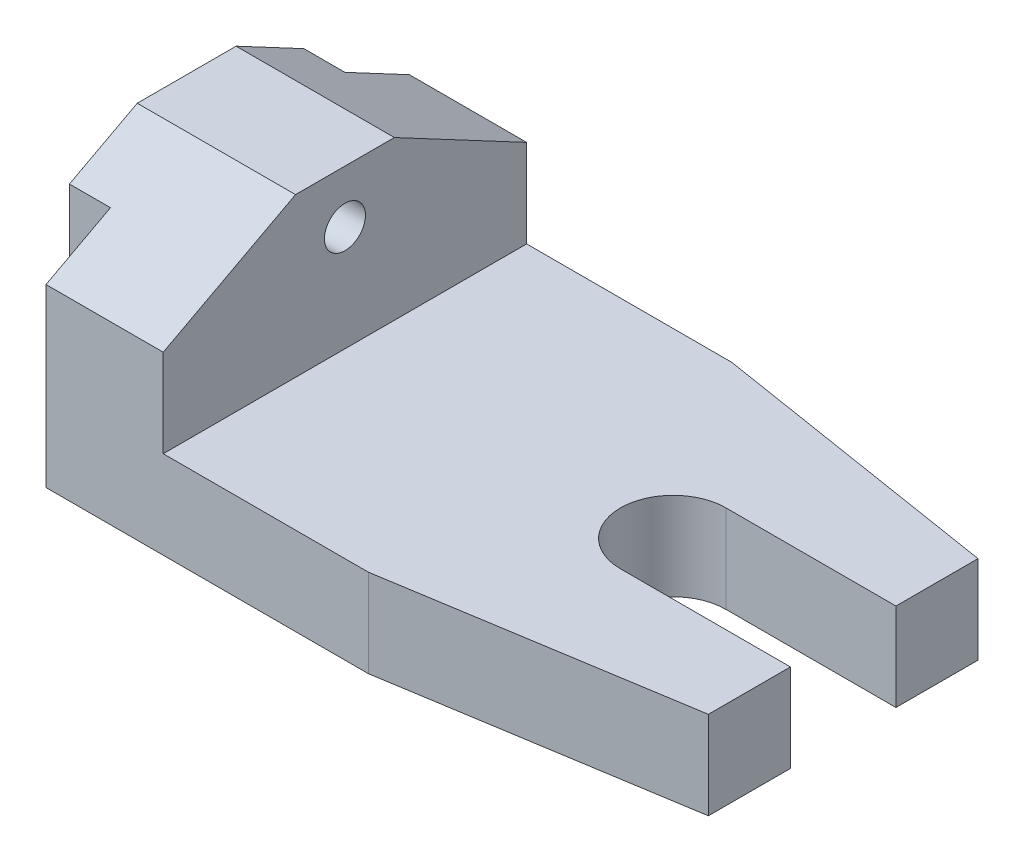
from build123d import *

# Parameters (mm, degrees)
BOSS_EXTRUDE1_DEPTH = 15
BOSS_EXTRUDE2_DEPTH = 42
CUT_EXTRUDE1_REACH  = 101.75
SKETCH2_R           = 3.5


with BuildPart() as part:
    # Sketch1 → Boss-Extrude1 (new body)
    with BuildSketch(Plane(origin=(0, 0, 0), x_dir=(1, 0, 0), z_dir=(0, 1, 0))):
        with BuildLine():
            ThreePointArc((83, -9), (74, 0), (83, 9))
            Line((83, 9), (112, 9))
            Line((112, 9), (112, 23))
            Line((112, 23), (62, 31))
            Line((62, 31), (27, 31))
            Line((27, 31), (27, -31))
            Line((27, -31), (62, -31))
            Line((62, -31), (112, -23))
            Line((112, -23), (112, -9))
            Line((112, -9), (83, -9))
        make_face()
    extrude(amount=BOSS_EXTRUDE1_DEPTH)

    # Sketch1<3> → Boss-Extrude2 (add)
    with BuildSketch(Plane(origin=(0, 0, 0), x_dir=(1, 0, 0), z_dir=(0, 1, 0))):
        Polygon((7, 20), (0, 20), (0, -20), (7, -20), (7, -31), (27, -31), (27, 31), (7, 31), align=None)
    extrude(amount=BOSS_EXTRUDE2_DEPTH)

    # Sketch2 → Cut-Extrude1 (cut, up to next)
    with BuildSketch(Plane(origin=(27, 0, 0), x_dir=(0, 0, -1), z_dir=(1, 0, 0)), mode=Mode.PRIVATE) as cut_extrude1_sk1:
        Polygon((31, 42), (8.431282416, 42), (31, 30), align=None)
    cut_extrude1_tool1 = extrude(cut_extrude1_sk1.sketch, amount=-CUT_EXTRUDE1_REACH, mode=Mode.PRIVATE) & part.part
    # Sketch2 → Cut-Extrude1 (cut, up to next)
    with BuildSketch(Plane(origin=(27, 0, 0), x_dir=(0, 0, -1), z_dir=(1, 0, 0)), mode=Mode.PRIVATE) as cut_extrude1_sk2:
        Polygon((-31, 30), (-8.431282416, 42), (-31, 42), align=None)
    cut_extrude1_tool2 = extrude(cut_extrude1_sk2.sketch, amount=-CUT_EXTRUDE1_REACH, mode=Mode.PRIVATE) & part.part
    # Sketch2 → Cut-Extrude1 (cut, up to next)
    with BuildSketch(Plane(origin=(27, 0, 0), x_dir=(0, 0, -1), z_dir=(1, 0, 0)), mode=Mode.PRIVATE) as cut_extrude1_sk3:
        with Locations((0, 33)):
            Circle(SKETCH2_R)
    cut_extrude1_tool3 = extrude(cut_extrude1_sk3.sketch, amount=-CUT_EXTRUDE1_REACH, mode=Mode.PRIVATE) & part.part
    add(cut_extrude1_tool1.solids().sort_by_distance((27, 38, -23.477094))[0], mode=Mode.SUBTRACT)
    add(cut_extrude1_tool2.solids().sort_by_distance((27, 38, 23.477094))[0], mode=Mode.SUBTRACT)
    add(cut_extrude1_tool3.solids().sort_by_distance((27, 33, 0))[0], mode=Mode.SUBTRACT)


solid = part.part
